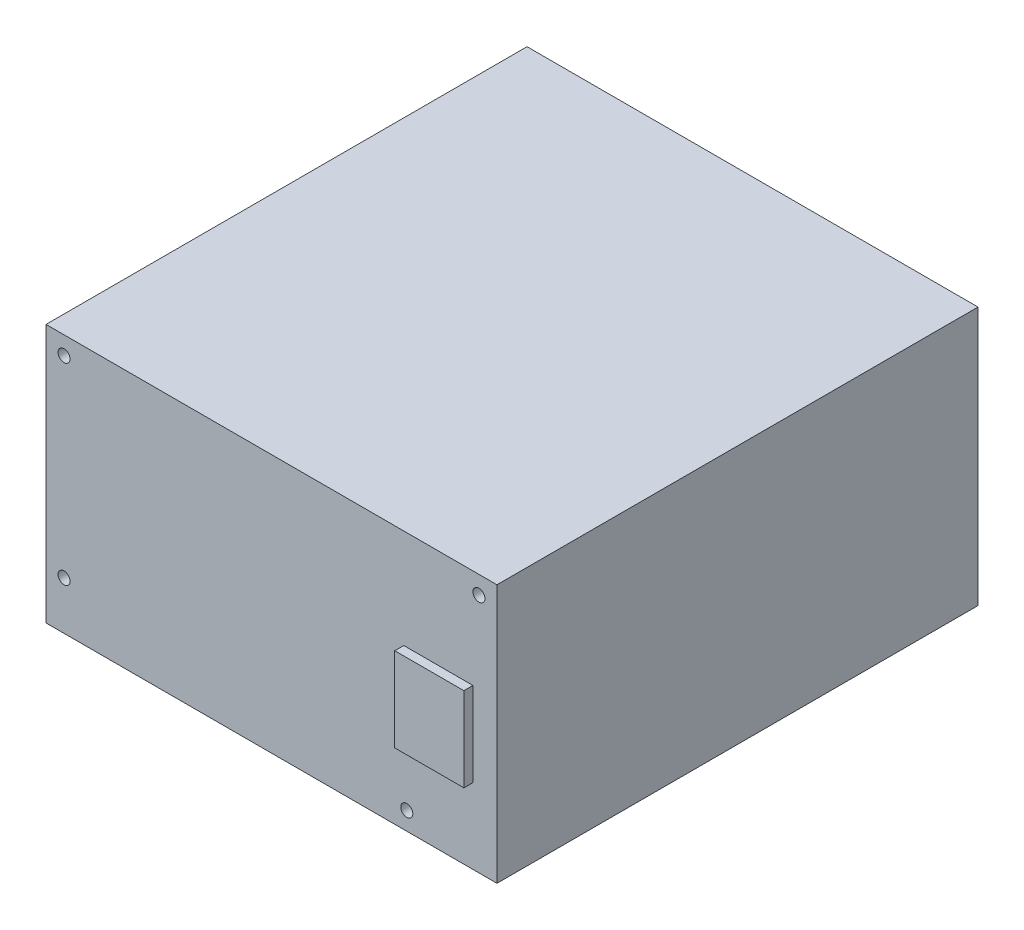
from build123d import *

# Parameters (mm, degrees)
SKETCH1_W           = 150
SKETCH1_H           = 160
BOSS_EXTRUDE1_DEPTH = 86
SKETCH6_W           = 23
SKETCH6_H           = 28
BOSS_EXTRUDE2_DEPTH = 3
SKETCH7_R           = 2
CUT_EXTRUDE1_DEPTH  = 3


with BuildPart() as part:
    # Sketch1 → Boss-Extrude1 (new body)
    with BuildSketch(Plane(origin=(0, 0, 0), x_dir=(1, 0, 0), z_dir=(0, 1, 0))):
        with Locations((75, 80)):
            Rectangle(SKETCH1_W, SKETCH1_H)
    extrude(amount=BOSS_EXTRUDE1_DEPTH)

    # Sketch6 → Boss-Extrude2 (add)
    with BuildSketch(Plane.XY):
        with Locations((130.5, 39)):
            Rectangle(SKETCH6_W, SKETCH6_H)
    extrude(amount=BOSS_EXTRUDE2_DEPTH)

    # Sketch7 → Cut-Extrude1 (cut)
    with BuildSketch(Plane.XY):
        with Locations((144, 80)):
            Circle(SKETCH7_R)
        with Locations(Location((6, 80, 0), (0, 0, 180))):
            Circle(SKETCH7_R)
        with Locations((6, 16)):
            Circle(SKETCH7_R)
        with Locations((120, 6)):
            Circle(SKETCH7_R)
    extrude(amount=-CUT_EXTRUDE1_DEPTH, mode=Mode.SUBTRACT)


solid = part.part
